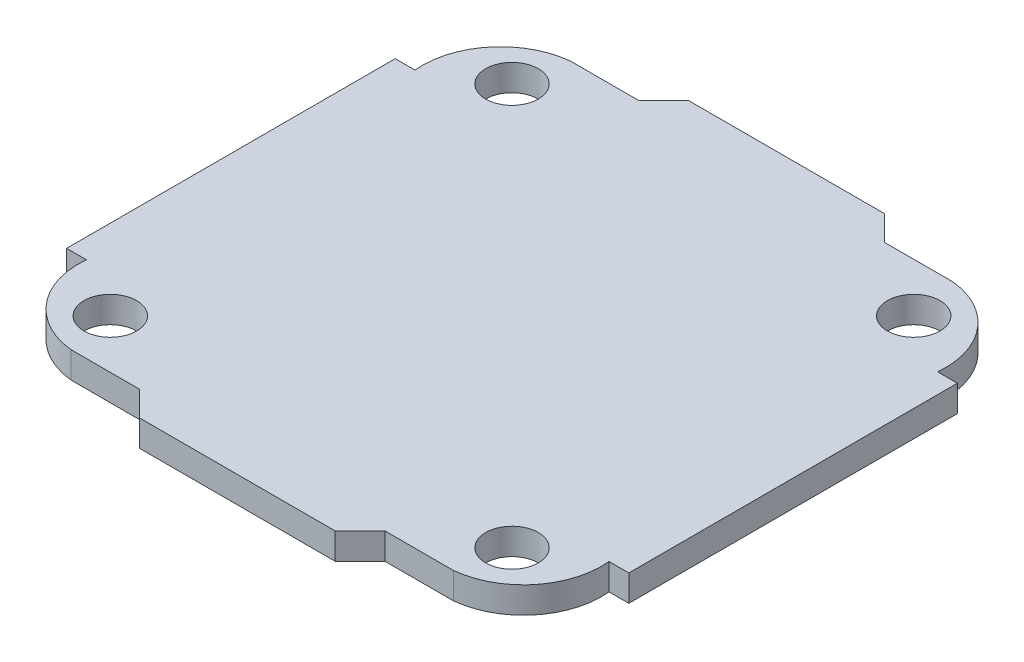
from build123d import *

# Parameters (mm, degrees)
SKETCH_1_R          = 2
EXTRUDE_1_DEPTH     = 2
CUT_EXTRUDE_1_DEPTH = 30.908699941


with BuildPart() as part:
    # 草图1 → 凸台-拉伸1 (new body)
    with BuildSketch(Plane(origin=(0, 0, 0), x_dir=(1, 0, 0), z_dir=(0, 1, 0))):
        Polygon((-19.887274719, -20.85738568), (19.887274719, -20.85738568), (21.342441161, -19.402219238), (21.342441161, 19.402219238), (19.887274719, 20.85738568), (-19.887274719, 20.85738568), (-21.342441161, 19.402219238), (-21.342441161, -19.402219238), align=None)
        with Locations(Location((15.25, 15.25, 0), (0, 0, 270))):
            Circle(SKETCH_1_R, mode=Mode.SUBTRACT)
        with Locations(Location((-15.25, 15.25, 0), (0, 0, 90))):
            Circle(SKETCH_1_R, mode=Mode.SUBTRACT)
        with Locations(Location((15.25, -15.25, 0), (0, 0, 90))):
            Circle(SKETCH_1_R, mode=Mode.SUBTRACT)
        with Locations(Location((-15.25, -15.25, 0), (0, 0, 270))):
            Circle(SKETCH_1_R, mode=Mode.SUBTRACT)
    extrude(amount=EXTRUDE_1_DEPTH)

    # 草图2 → 切除-拉伸1 (cut, through all)
    with BuildSketch(Plane(origin=(0, 2, 0), x_dir=(1, 0, 0), z_dir=(0, 1, 0))):
        with BuildLine():
            Line((-19.842796432, 12.473949701), (-21.342441161, 12.473949701))
            Line((-21.342441161, 12.473949701), (-21.342441161, 20.85738568))
            Line((-21.342441161, 20.85738568), (-7.423925003, 20.85738568))
            Line((-7.423925003, 20.85738568), (-9.313125328, 18.968185355))
            Line((-9.313125328, 18.968185355), (-14.512267744, 18.968185355))
            ThreePointArc((-14.512267744, 18.968185355), (-18.522532331, 16.825056167), (-19.842796432, 12.473949701))
        make_face()
        with BuildLine():
            Line((7.423925003, 20.85738568), (21.342441161, 20.85738568))
            Line((21.342441161, 20.85738568), (21.342441161, 12.473949701))
            Line((21.342441161, 12.473949701), (19.842796432, 12.473949701))
            ThreePointArc((19.842796432, 12.473949701), (18.522532331, 16.825056167), (14.512267744, 18.968185355))
            Line((14.512267744, 18.968185355), (9.313125328, 18.968185355))
            Line((9.313125328, 18.968185355), (7.423925003, 20.85738568))
        make_face()
        with BuildLine():
            Line((9.313125328, -18.968185355), (7.423925003, -20.85738568))
            Line((7.423925003, -20.85738568), (21.342441161, -20.85738568))
            Line((21.342441161, -20.85738568), (21.342441161, -12.473949701))
            Line((21.342441161, -12.473949701), (19.842796432, -12.473949701))
            ThreePointArc((19.842796432, -12.473949701), (18.522532331, -16.825056167), (14.512267744, -18.968185355))
            Line((14.512267744, -18.968185355), (9.313125328, -18.968185355))
        make_face()
        with BuildLine():
            Line((-7.423925003, -20.85738568), (-21.342441161, -20.85738568))
            Line((-21.342441161, -20.85738568), (-21.342441161, -12.473949701))
            Line((-21.342441161, -12.473949701), (-19.842796432, -12.473949701))
            ThreePointArc((-19.842796432, -12.473949701), (-18.522532331, -16.825056167), (-14.512267744, -18.968185355))
            Line((-14.512267744, -18.968185355), (-9.313125328, -18.968185355))
            Line((-9.313125328, -18.968185355), (-7.423925003, -20.85738568))
        make_face()
    extrude(amount=-CUT_EXTRUDE_1_DEPTH, mode=Mode.SUBTRACT)


solid = part.part
